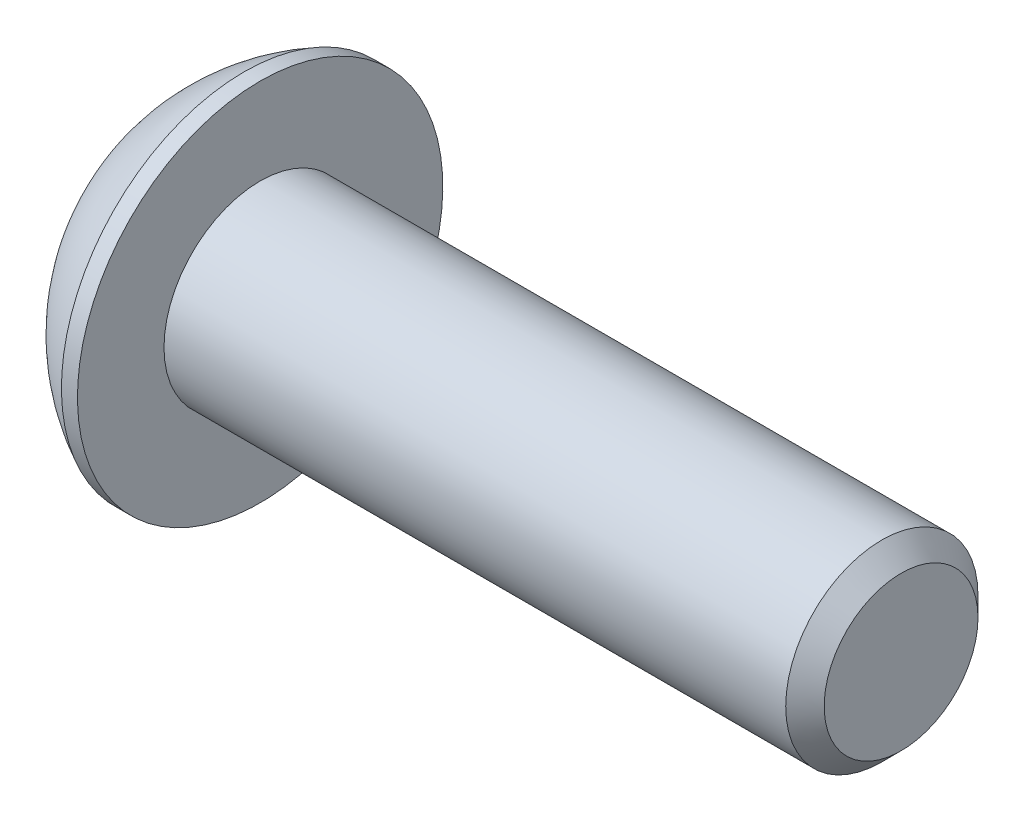
from build123d import *

# Parameters (mm, degrees)
SKETCH2_R           = 1.5
BOSS_EXTRUDE1_DEPTH = 10
CHAMFER1_SIZE       = 0.3
CUT_EXTRUDE1_DEPTH  = 1.2
SKETCH8_R           = 1.204700538
CUT_EXTRUDE2_DEPTH  = 1
CUT_EXTRUDE2_DRAFT  = -45


with BuildPart() as part:
    # Sketch2 → Boss-Extrude1 (new body)
    with BuildSketch(Plane(origin=(0, 0, 0), x_dir=(0, 0, -1), z_dir=(1, 0, 0))):
        Circle(SKETCH2_R)
    extrude(amount=-BOSS_EXTRUDE1_DEPTH)

    # Chamfer1
    chamfer1_edges = [part.edges().sort_by_distance(p)[0] for p in [
        (0, 0, 1.5),
    ]]
    chamfer(chamfer1_edges, length=CHAMFER1_SIZE)

    # Sketch6 → Revolve1 (revolve)
    with BuildSketch(Plane.XY):
        with BuildLine():
            Line((-11.65, 0), (-11.65, 1.5))
            ThreePointArc((-11.65, 1.5), (-11.055944823, 2.284868705), (-10.25, 2.85))
            Line((-10.25, 2.85), (-10, 2.85))
            Line((-10, 2.85), (-10, 0))
            Line((-10, 0), (-11.65, 0))
        make_face()
    revolve(axis=Axis((-10, 0, 0), (-1, 0, 0)))

    # Sketch7 → Cut-Extrude1 (cut)
    with BuildSketch(Plane.ZY.offset(11.65)):
        Polygon((0, 1.154700538), (-1, 0.577350269), (-1, -0.577350269), (0, -1.154700538), (1, -0.577350269), (1, 0.577350269), align=None)
    extrude(amount=-CUT_EXTRUDE1_DEPTH, mode=Mode.SUBTRACT)


with BuildPart() as cut_extrude2_tool:
    # Sketch8 → Cut-Extrude2 (with draft: the straight prism first)
    with BuildSketch(Plane.ZY.offset(11.65)):
        Circle(SKETCH8_R)
    extrude(amount=-CUT_EXTRUDE2_DEPTH)
    # Cut-Extrude2: the draft: its side faces are tilted about the plane it starts from
    cut_extrude2_sides = [cut_extrude2_tool.faces().sort_by_distance(p)[0] for p in [
        (-11.15, 0, -1.204700538),
    ]]
    draft(cut_extrude2_sides, Plane.ZY.offset(11.65), CUT_EXTRUDE2_DRAFT)


with BuildPart() as part_1:
    add(part.part)

    # Cut-Extrude2: cut by cut_extrude2_tool
    add(cut_extrude2_tool.part, mode=Mode.SUBTRACT)


solid = part_1.part
